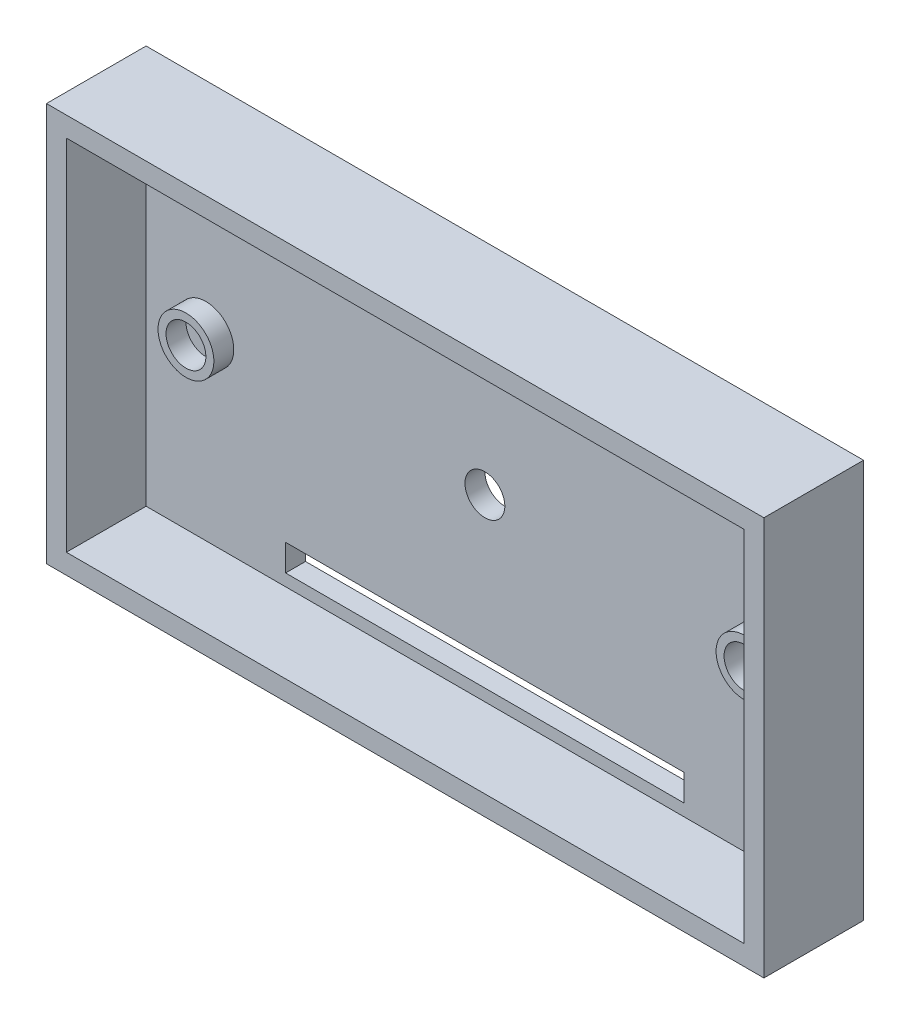
from build123d import *

# Parameters (mm, degrees)
SKETCH1_W           = 114.3
SKETCH1_H           = 63.5
BOSS_EXTRUDE1_DEPTH = 3.175
SKETCH2_W           = 114.3
SKETCH2_H           = 63.5
SKETCH2_W_2         = 107.95
SKETCH2_H_2         = 57.15
BOSS_EXTRUDE2_DEPTH = 12.7
CUT_EXTRUDE1_REACH  = 69.277
SKETCH3_R           = 3.175
SKETCH3_W           = 63.5
SKETCH3_H           = 4.233333418
SKETCH4_R           = 4.445
SKETCH4_R_2         = 3.175
BOSS_EXTRUDE3_DEPTH = 3.175


with BuildPart() as part:
    # Sketch1 → Boss-Extrude1 (new body)
    with BuildSketch(Plane.XY):
        Rectangle(SKETCH1_W, SKETCH1_H)
    extrude(amount=BOSS_EXTRUDE1_DEPTH)

    # Sketch2 → Boss-Extrude2 (add)
    with BuildSketch(Plane.XY.offset(3.175)):
        Rectangle(SKETCH2_W, SKETCH2_H)
        Rectangle(SKETCH2_W_2, SKETCH2_H_2, mode=Mode.SUBTRACT)
    extrude(amount=BOSS_EXTRUDE2_DEPTH)

    # Sketch3 → Cut-Extrude1 (cut, up to next)
    with BuildSketch(Plane(origin=(0, 0, 0), x_dir=(-1, 0, 0), z_dir=(0, 0, -1)), mode=Mode.PRIVATE) as cut_extrude1_sk1:
        Circle(SKETCH3_R)
    cut_extrude1_tool1 = extrude(cut_extrude1_sk1.sketch, amount=-CUT_EXTRUDE1_REACH, mode=Mode.PRIVATE) & part.part
    # Sketch3 → Cut-Extrude1 (cut, up to next)
    with BuildSketch(Plane(origin=(0, 0, 0), x_dir=(-1, 0, 0), z_dir=(0, 0, -1)), mode=Mode.PRIVATE) as cut_extrude1_sk2:
        with Locations((0, 24.553333291)):
            Rectangle(SKETCH3_W, SKETCH3_H)
    cut_extrude1_tool2 = extrude(cut_extrude1_sk2.sketch, amount=-CUT_EXTRUDE1_REACH, mode=Mode.PRIVATE) & part.part
    # Sketch3 → Cut-Extrude1 (cut, up to next)
    with BuildSketch(Plane(origin=(0, 0, 0), x_dir=(-1, 0, 0), z_dir=(0, 0, -1)), mode=Mode.PRIVATE) as cut_extrude1_sk3:
        with Locations((0, -24.553333291)):
            Rectangle(SKETCH3_W, SKETCH3_H)
    cut_extrude1_tool3 = extrude(cut_extrude1_sk3.sketch, amount=-CUT_EXTRUDE1_REACH, mode=Mode.PRIVATE) & part.part
    add(cut_extrude1_tool1.solids().sort_by_distance((0, 0, 0))[0], mode=Mode.SUBTRACT)
    add(cut_extrude1_tool2.solids().sort_by_distance((0, 24.553333, 0))[0], mode=Mode.SUBTRACT)
    add(cut_extrude1_tool3.solids().sort_by_distance((0, -24.553333, 0))[0], mode=Mode.SUBTRACT)

    # Sketch4 → Boss-Extrude3 (add)
    # profile 1 of 2: a face of its own
    with BuildSketch(Plane.XY.offset(3.175)):
        with Locations(Location((44.45, 0, 0), (0, 0, 180))):
            Circle(SKETCH4_R)
        with Locations((44.45, 0)):
            Circle(SKETCH4_R_2, mode=Mode.SUBTRACT)
    # profile 2 of 2: a face of its own
    with BuildSketch(Plane.XY.offset(3.175)):
        with Locations(Location((-44.45, 0, 0), (0, 0, 180))):
            Circle(SKETCH4_R)
        with Locations(Location((-44.45, 0, 0), (0, 0, 180))):
            Circle(SKETCH4_R_2, mode=Mode.SUBTRACT)
    extrude(amount=BOSS_EXTRUDE3_DEPTH)


solid = part.part
